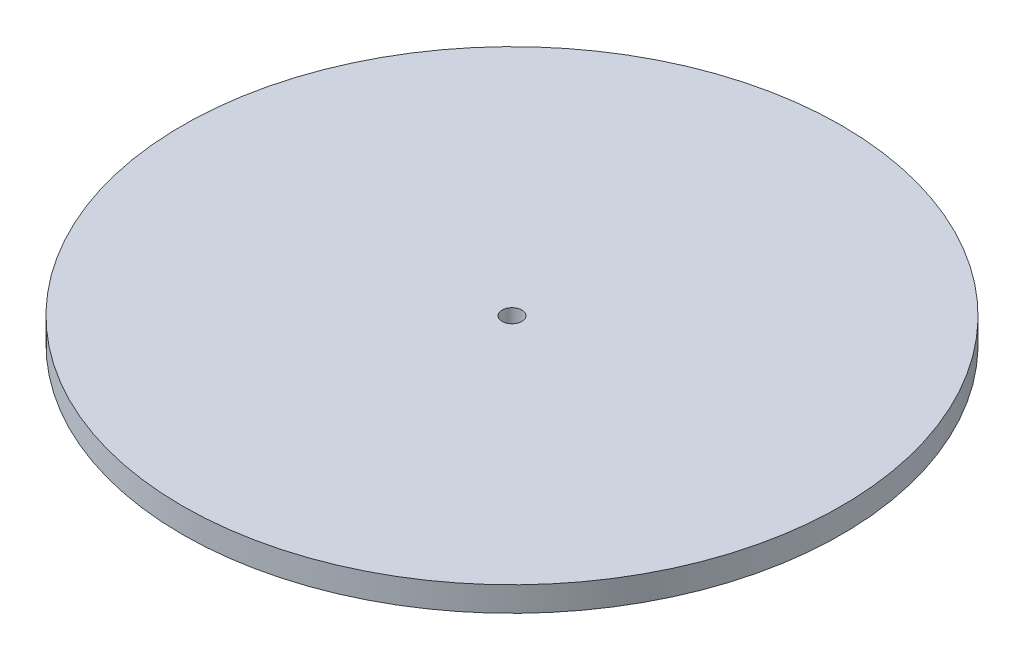
from build123d import *

# Parameters (mm, degrees)
SKETCH5_R          = 1.2
CUT_EXTRUDE1_DEPTH = 58.594599617


with BuildPart() as part:
    # Sketch3 → Revolve4 (revolve)
    with BuildSketch(Plane.XY, mode=Mode.PRIVATE) as revolve4_sk:
        with BuildLine():
            Line((1.2, 10.823026514), (1.2, 5.823026514))
            Line((1.2, 5.823026514), (0, 5.823026514))
            Line((0, 5.823026514), (0, 0))
            add(Edge.make_bspline(
                [(0, 0), (4.624999999, 0.001145005), (9.249999999, 0.42849104), (13.874999999, 1.324279285), (18.499999999, 2.344324843), (23.124999999, 3.440870331), (27.749999999, 4.570268909), (32.375, 5.700230023), (37, 6.823026514)],
                knots=[0.08340306, 0.08340306, 0.08340306, 0.08340306, 0.08340306, 0.08340306, 0.08340306, 0.08340306, 0.08340306, 0.917433662, 0.917433662, 0.917433662, 0.917433662, 0.917433662, 0.917433662, 0.917433662, 0.917433662, 0.917433662], degree=8))
            Line((37, 6.823026514), (37, 7.823026514))
            Line((37, 7.823026514), (40, 7.823026514))
            Line((40, 7.823026514), (40, 10.823026514))
            Line((40, 10.823026514), (1.2, 10.823026514))
        make_face()
    revolve(revolve4_sk.sketch.rotate(Axis((0, 10.823026514, 0), (0, -1, 0)), 90), axis=Axis((0, 10.823026514, 0), (0, -1, 0)))

    # Sketch5 → Cut-Extrude1 (cut, through all)
    with BuildSketch(Plane(origin=(0, 10.823026514, 0), x_dir=(1, 0, 0), z_dir=(0, 1, 0))):
        with Locations(Location((0, 0, 0), (0, 0, 270))):
            Circle(SKETCH5_R)
    extrude(amount=-CUT_EXTRUDE1_DEPTH, mode=Mode.SUBTRACT)


solid = part.part
